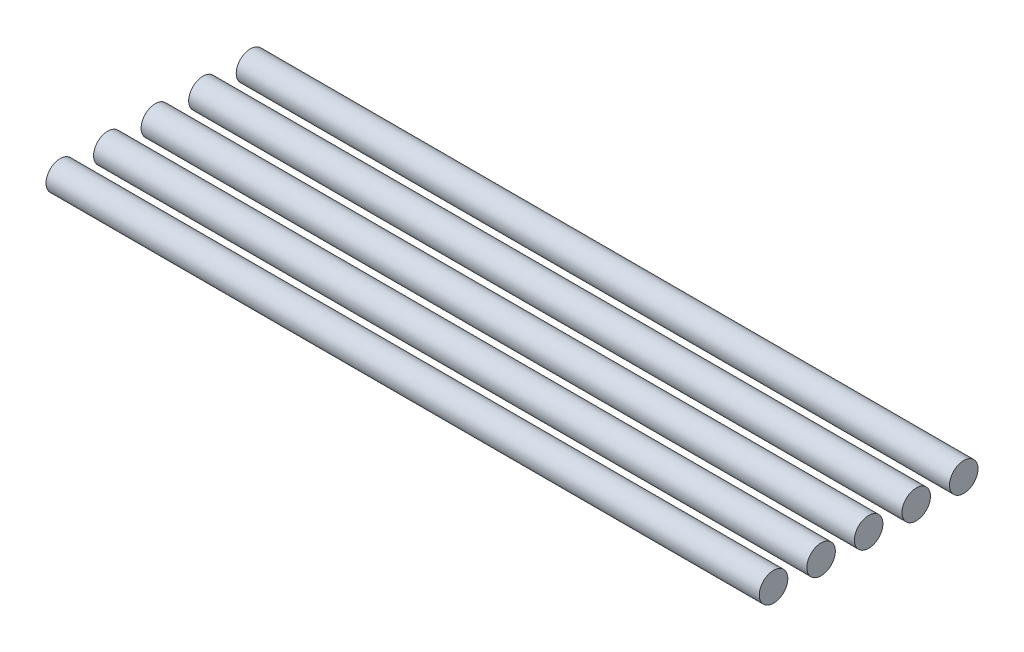
from build123d import *

# Parameters (mm, degrees)
SKETCH1_R             = 0.762
BOSS_EXTRUDE1_DEPTH   = 19.05
BOSS_EXTRUDE1_2_DEPTH = 19.05
BOSS_EXTRUDE1_3_DEPTH = 19.05
BOSS_EXTRUDE1_4_DEPTH = 19.05
BOSS_EXTRUDE1_5_DEPTH = 19.05


with BuildPart() as part:
    # Sketch1 → Boss-Extrude1 (new, symmetric)
    with BuildSketch(Plane(origin=(0, 0, 0), x_dir=(0, 0, -1), z_dir=(1, 0, 0))):
        with Locations(Location((0, 0, 0), (0, 0, 180))):
            Circle(SKETCH1_R)
    extrude(amount=BOSS_EXTRUDE1_DEPTH, both=True)


with BuildPart() as body_2:
    # Sketch1 → Boss-Extrude1 2 (new, symmetric)
    with BuildSketch(Plane(origin=(0, 0, 0), x_dir=(0, 0, -1), z_dir=(1, 0, 0))):
        with Locations(Location((-5.08, 0, 0), (0, 0, 180))):
            Circle(SKETCH1_R)
    extrude(amount=BOSS_EXTRUDE1_2_DEPTH, both=True)


with BuildPart() as body_3:
    # Sketch1 → Boss-Extrude1 3 (new, symmetric)
    with BuildSketch(Plane(origin=(0, 0, 0), x_dir=(0, 0, -1), z_dir=(1, 0, 0))):
        with Locations(Location((-2.54, 0, 0), (0, 0, 180))):
            Circle(SKETCH1_R)
    extrude(amount=BOSS_EXTRUDE1_3_DEPTH, both=True)


with BuildPart() as body_4:
    # Sketch1 → Boss-Extrude1 4 (new, symmetric)
    with BuildSketch(Plane(origin=(0, 0, 0), x_dir=(0, 0, -1), z_dir=(1, 0, 0))):
        with Locations(Location((2.54, 0, 0), (0, 0, 180))):
            Circle(SKETCH1_R)
    extrude(amount=BOSS_EXTRUDE1_4_DEPTH, both=True)


with BuildPart() as body_5:
    # Sketch1 → Boss-Extrude1 5 (new, symmetric)
    with BuildSketch(Plane(origin=(0, 0, 0), x_dir=(0, 0, -1), z_dir=(1, 0, 0))):
        with Locations(Location((5.08, 0, 0), (0, 0, 180))):
            Circle(SKETCH1_R)
    extrude(amount=BOSS_EXTRUDE1_5_DEPTH, both=True)


solid = Compound([part.part, body_2.part, body_3.part, body_4.part, body_5.part])
